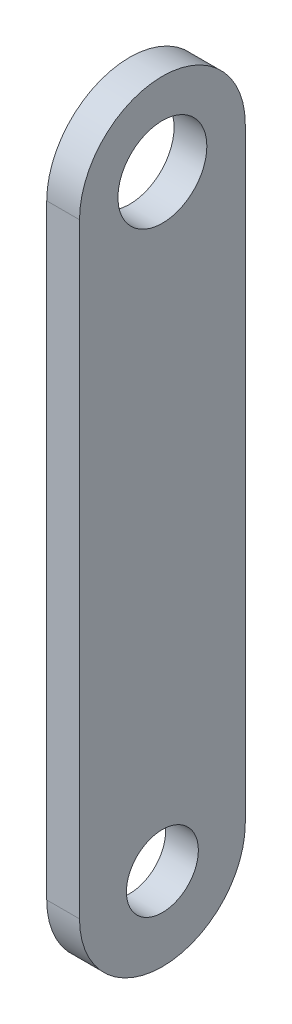
from build123d import *

# Parameters (mm, degrees)
SKETCH_1_R      = 6.783510382
SKETCH_1_R_2    = 5.491160117
EXTRUDE_1_DEPTH = 5


with BuildPart() as part:
    # 草图1 → 凸台-拉伸1 (new body)
    with BuildSketch(Plane(origin=(0, 0, 0), x_dir=(0, 0, -1), z_dir=(1, 0, 0))):
        with BuildLine():
            Line((-12.647461948, 0), (-12.647461948, 92.4))
            ThreePointArc((-12.647461948, 92.4), (0, 105.047461948), (12.647461948, 92.4))
            Line((12.647461948, 92.4), (12.647461948, 0))
            ThreePointArc((12.647461948, 0), (0, -12.647461948), (-12.647461948, 0))
        make_face()
        with Locations((0, 92.4)):
            Circle(SKETCH_1_R, mode=Mode.SUBTRACT)
        Circle(SKETCH_1_R_2, mode=Mode.SUBTRACT)
    extrude(amount=EXTRUDE_1_DEPTH)


solid = part.part
